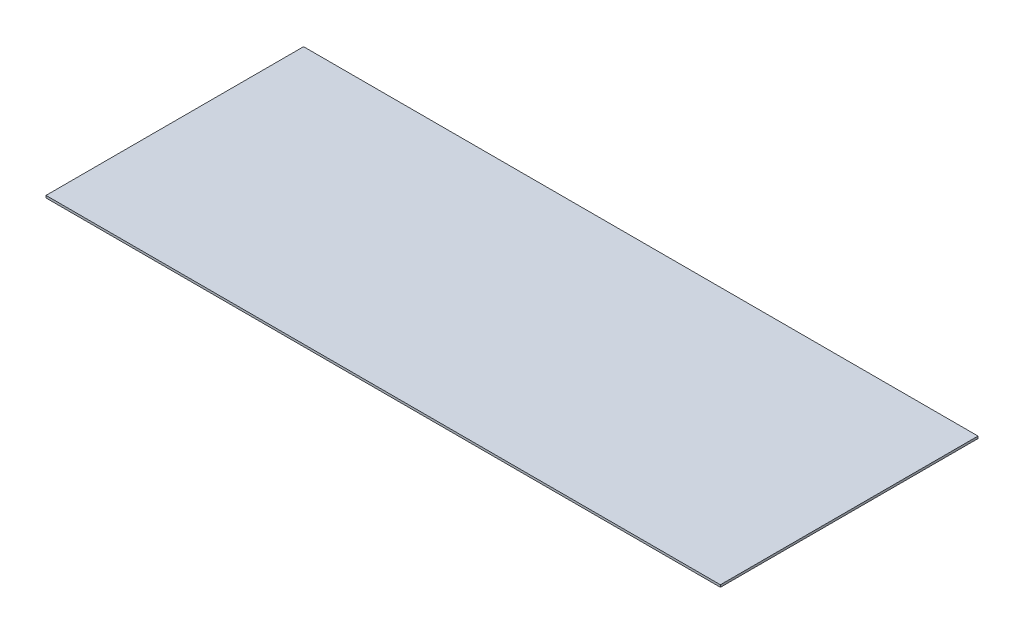
from build123d import *

# Parameters (mm, degrees)
SKETCH1_W           = 457.2
SKETCH1_H           = 174.625
BOSS_EXTRUDE1_DEPTH = 1.51892


with BuildPart() as part:
    # Sketch1 → Boss-Extrude1 (new body)
    with BuildSketch(Plane(origin=(0, 0, 0), x_dir=(1, 0, 0), z_dir=(0, 1, 0))):
        with Locations((126.823369918, -35.693031007)):
            Rectangle(SKETCH1_W, SKETCH1_H)
    extrude(amount=-BOSS_EXTRUDE1_DEPTH)


solid = part.part
